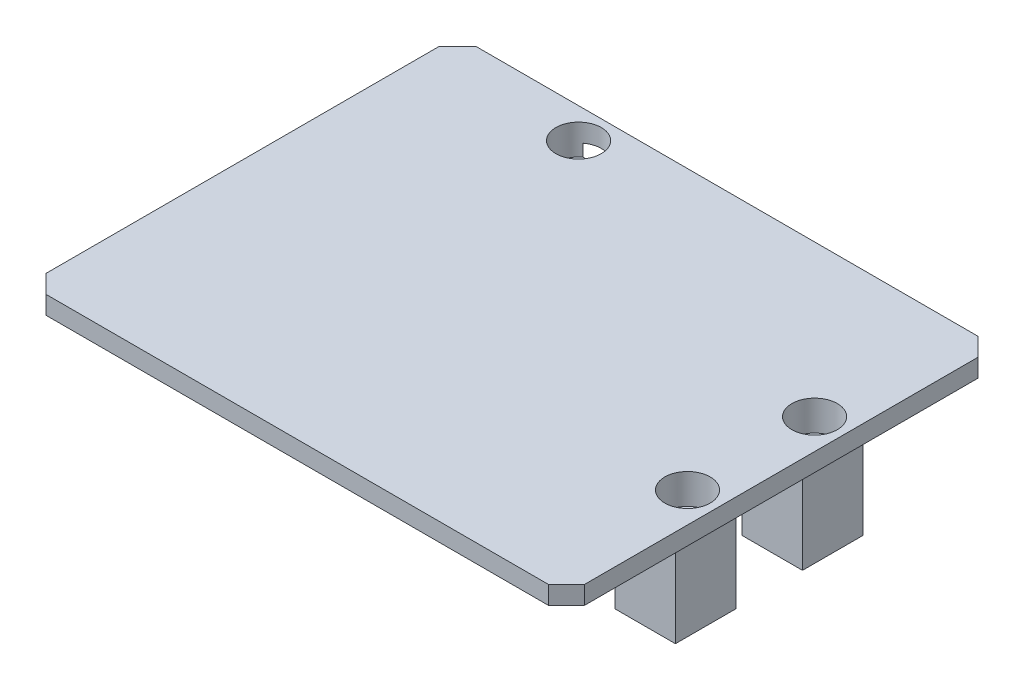
from build123d import *

# Parameters (mm, degrees)
SKETCH1_W           = 85
SKETCH1_H           = 67
BOSS_EXTRUDE1_DEPTH = 3
SKETCH1_3_W         = 89
SKETCH1_3_H         = 71
SKETCH1_3_W_2       = 85
SKETCH1_3_H_2       = 67
BOSS_EXTRUDE2_DEPTH = 50
CHAMFER1_SIZE       = 3
SKETCH2_W           = 10
SKETCH2_H           = 10
SKETCH2_R           = 2.1
BOSS_EXTRUDE3_DEPTH = 32
CUT_EXTRUDE1_START  = 3
SKETCH1_4_W         = 89
SKETCH1_4_H         = 71
SKETCH1_4_W_2       = 85
SKETCH1_4_H_2       = 67
CUT_EXTRUDE1_DEPTH  = 73.766087401
CUT_EXTRUDE2_START  = 15
SKETCH2_2_W         = 10
SKETCH2_2_H         = 10
SKETCH2_2_R         = 2.1
CUT_EXTRUDE2_DEPTH  = 51.303139281
SKETCH3_R           = 3.75
CUT_EXTRUDE3_DEPTH  = 5
CUT_EXTRUDE4_START  = 15
SKETCH4_W           = 102.54435907
SKETCH4_H           = 82.358611279
CUT_EXTRUDE4_DEPTH  = 40


with BuildPart() as part:
    # Sketch1 → Boss-Extrude1 (new body)
    with BuildSketch(Plane(origin=(0, 0, 0), x_dir=(1, 0, 0), z_dir=(0, 1, 0))):
        Rectangle(SKETCH1_W, SKETCH1_H)
    extrude(amount=BOSS_EXTRUDE1_DEPTH)

    # Sketch1<3> → Boss-Extrude2 (add)
    with BuildSketch(Plane(origin=(0, 0, 0), x_dir=(1, 0, 0), z_dir=(0, 1, 0))):
        Rectangle(SKETCH1_3_W, SKETCH1_3_H)
        Rectangle(SKETCH1_3_W_2, SKETCH1_3_H_2, mode=Mode.SUBTRACT)
    extrude(amount=BOSS_EXTRUDE2_DEPTH)

    # Chamfer1
    chamfer1_edges = [part.edges().sort_by_distance(p)[0] for p in [
        (-44.5, 25, -35.5),
        (-44.5, 25, 35.5),
        (44.5, 25, 35.5),
        (44.5, 25, -35.5),
    ]]
    chamfer(chamfer1_edges, length=CHAMFER1_SIZE)

    # Sketch2 → Boss-Extrude3 (add)
    # profile 1 of 3: a face of its own
    with BuildSketch(Plane(origin=(0, 3, 0), x_dir=(1, 0, 0), z_dir=(0, 1, 0))):
        with Locations((-19.5, 28.5)):
            Rectangle(SKETCH2_W, SKETCH2_H)
        with Locations(Location((-19.5, 30.5, 0), (0, 0, 90))):
            Circle(SKETCH2_R, mode=Mode.SUBTRACT)
    # profile 2 of 3: a face of its own
    with BuildSketch(Plane(origin=(0, 3, 0), x_dir=(1, 0, 0), z_dir=(0, 1, 0))):
        with Locations((37.5, 10.5)):
            Rectangle(SKETCH2_W, SKETCH2_H)
        with Locations(Location((39.5, 10.5, 0), (0, 0, 90))):
            Circle(SKETCH2_R, mode=Mode.SUBTRACT)
    # profile 3 of 3: a face of its own
    with BuildSketch(Plane(origin=(0, 3, 0), x_dir=(1, 0, 0), z_dir=(0, 1, 0))):
        with Locations((37.5, -10.5)):
            Rectangle(SKETCH2_W, SKETCH2_H)
        with Locations(Location((39.5, -10.5, 0), (0, 0, 90))):
            Circle(SKETCH2_R, mode=Mode.SUBTRACT)
    extrude(amount=BOSS_EXTRUDE3_DEPTH)

    # Sketch1<4> → Cut-Extrude1 (cut, through all)
    with BuildSketch(Plane(origin=(0, 0, 0), x_dir=(1, 0, 0), z_dir=(0, 1, 0)).offset(CUT_EXTRUDE1_START)):
        Rectangle(SKETCH1_4_W, SKETCH1_4_H)
        Rectangle(SKETCH1_4_W_2, SKETCH1_4_H_2, mode=Mode.SUBTRACT)
    extrude(amount=CUT_EXTRUDE1_DEPTH, mode=Mode.SUBTRACT)

    # Sketch2<2> → Cut-Extrude2 (cut, through all)
    # profile 1 of 3: a face of its own
    with BuildSketch(Plane(origin=(0, 3, 0), x_dir=(1, 0, 0), z_dir=(0, 1, 0)).offset(CUT_EXTRUDE2_START)):
        with Locations((-19.5, 28.5)):
            Rectangle(SKETCH2_2_W, SKETCH2_2_H)
        with Locations(Location((-19.5, 30.5, 0), (0, 0, 90))):
            Circle(SKETCH2_2_R, mode=Mode.SUBTRACT)
    # profile 2 of 3: a face of its own
    with BuildSketch(Plane(origin=(0, 3, 0), x_dir=(1, 0, 0), z_dir=(0, 1, 0)).offset(CUT_EXTRUDE2_START)):
        with Locations((37.5, 10.5)):
            Rectangle(SKETCH2_2_W, SKETCH2_2_H)
        with Locations(Location((39.5, 10.5, 0), (0, 0, 90))):
            Circle(SKETCH2_2_R, mode=Mode.SUBTRACT)
    # profile 3 of 3: a face of its own
    with BuildSketch(Plane(origin=(0, 3, 0), x_dir=(1, 0, 0), z_dir=(0, 1, 0)).offset(CUT_EXTRUDE2_START)):
        with Locations((37.5, -10.5)):
            Rectangle(SKETCH2_2_W, SKETCH2_2_H)
        with Locations(Location((39.5, -10.5, 0), (0, 0, 90))):
            Circle(SKETCH2_2_R, mode=Mode.SUBTRACT)
    extrude(amount=CUT_EXTRUDE2_DEPTH, mode=Mode.SUBTRACT)

    # Sketch3 → Cut-Extrude3 (cut)
    with BuildSketch(Plane.XZ):
        with Locations(Location((-19.5, -30.5, 0), (0, 0, 270))):
            Circle(SKETCH3_R)
        with Locations(Location((39.5, -10.5, 0), (0, 0, 270))):
            Circle(SKETCH3_R)
        with Locations(Location((39.5, 10.5, 0), (0, 0, 270))):
            Circle(SKETCH3_R)
    extrude(amount=-CUT_EXTRUDE3_DEPTH, mode=Mode.SUBTRACT)

    # Mirror5: part across plane


with BuildPart() as part_1:
    add(part.part)
    add(part.part.mirror(Plane.ZX.offset(18)))

    # Sketch4 → Cut-Extrude4 (cut)
    with BuildSketch(Plane.XZ.offset(-33).offset(CUT_EXTRUDE4_START)):
        with Locations((-1.663138354, 2.062291559)):
            Rectangle(SKETCH4_W, SKETCH4_H)
    extrude(amount=CUT_EXTRUDE4_DEPTH, mode=Mode.SUBTRACT)


solid = part_1.part
